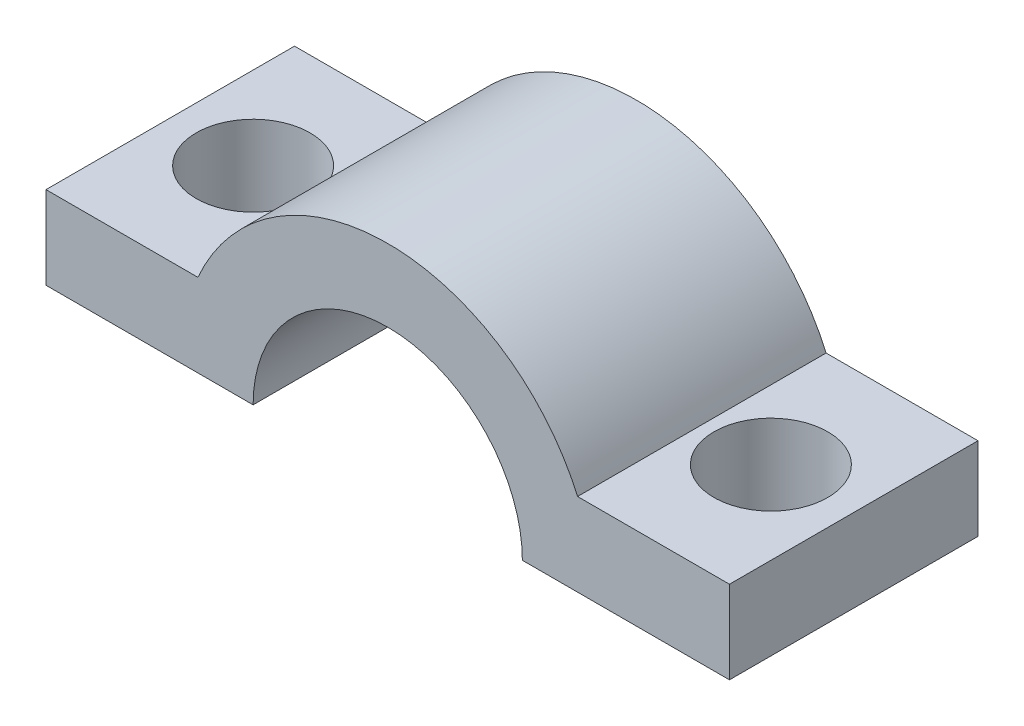
from build123d import *

# Parameters (mm, degrees)
EXTRUDE_1_DEPTH     = 12
SKETCH_2_R          = 5.5
CUT_EXTRUDE_1_DEPTH = 38.107950631


with BuildPart() as part:
    # 草图1 → 凸台-拉伸1 (new, symmetric)
    with BuildSketch(Plane.XY):
        with BuildLine():
            Line((-33, 0), (-33, 8))
            Line((-33, 8), (-18.33030278, 8))
            ThreePointArc((-18.33030278, 8), (0, 20), (18.33030278, 8))
            Line((18.33030278, 8), (33, 8))
            Line((33, 8), (33, 0))
            Line((33, 0), (13, 0))
            ThreePointArc((13, 0), (0, 13), (-13, 0))
            Line((-13, 0), (-33, 0))
        make_face()
    extrude(amount=EXTRUDE_1_DEPTH, both=True)

    # 草图2 → 切除-拉伸1 (cut, through all)
    with BuildSketch(Plane(origin=(0, 8, 0), x_dir=(1, 0, 0), z_dir=(0, 1, 0))):
        with Locations(Location((25, 0, 0), (0, 0, 180))):
            Circle(SKETCH_2_R)
        with Locations((-25, 0)):
            Circle(SKETCH_2_R)
    extrude(amount=-CUT_EXTRUDE_1_DEPTH, mode=Mode.SUBTRACT)


solid = part.part
